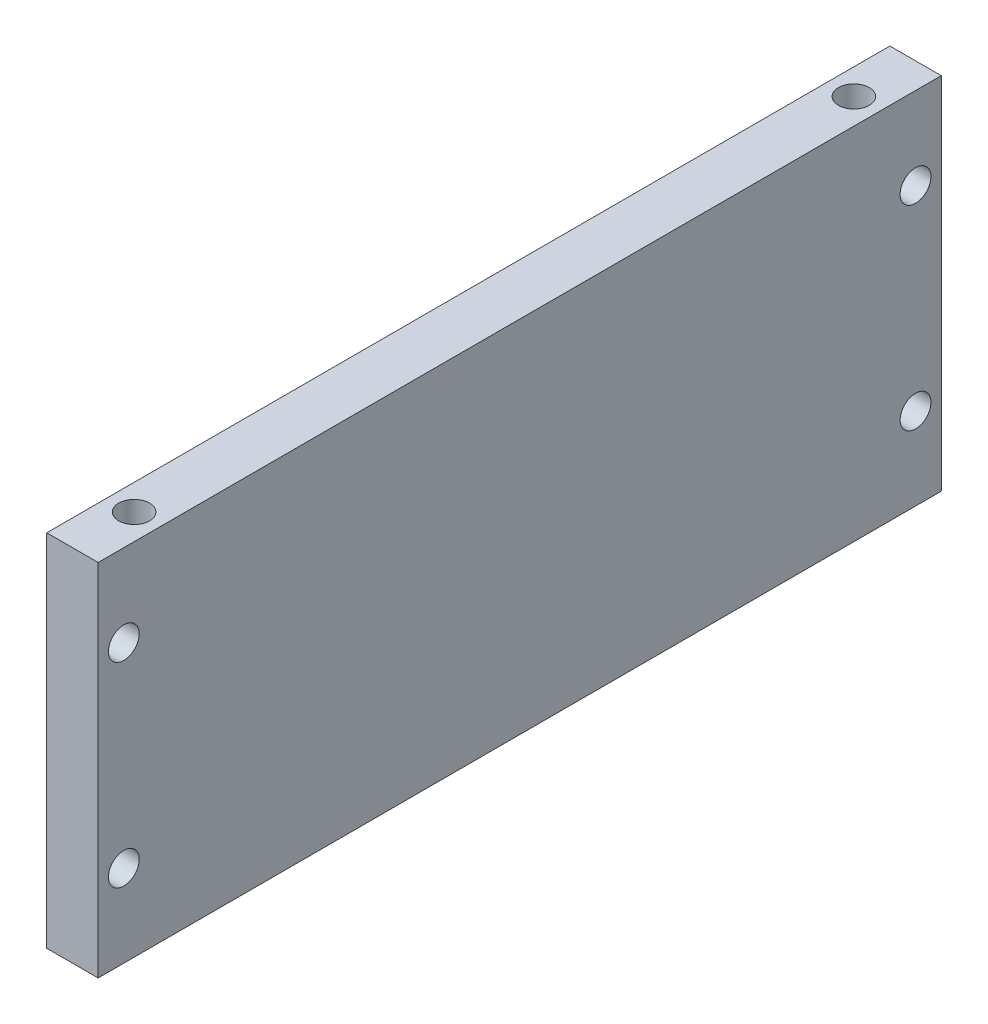
from build123d import *

# Parameters (mm, degrees)
SKETCH1_W           = 82
SKETCH1_H           = 35
BOSS_EXTRUDE1_DEPTH = 5
SKETCH2_R           = 1.5
CUT_EXTRUDE1_DEPTH  = 4
SKETCH3_R           = 1.5
CUT_EXTRUDE2_DEPTH  = 4
CUT_EXTRUDE3_START  = -4
SKETCH4_R           = 1.5
CUT_EXTRUDE3_DEPTH  = 4


with BuildPart() as part:
    # Sketch1 → Boss-Extrude1 (new body)
    with BuildSketch(Plane(origin=(0, 0, 0), x_dir=(0, 0, -1), z_dir=(1, 0, 0))):
        Rectangle(SKETCH1_W, SKETCH1_H)
    extrude(amount=BOSS_EXTRUDE1_DEPTH)

    # Sketch2 → Cut-Extrude1 (cut)
    with BuildSketch(Plane(origin=(5, 0, 0), x_dir=(0, 0, -1), z_dir=(1, 0, 0))):
        with Locations((-38.5, 9.5)):
            Circle(SKETCH2_R)
        with Locations(Location((-38.5, -9.5, 0), (0, 0, 180))):
            Circle(SKETCH2_R)
        with Locations((38.5, -9.5)):
            Circle(SKETCH2_R)
        with Locations(Location((38.5, 9.5, 0), (0, 0, 180))):
            Circle(SKETCH2_R)
    extrude(amount=-CUT_EXTRUDE1_DEPTH, mode=Mode.SUBTRACT)

    # Sketch3 → Cut-Extrude2 (cut)
    with BuildSketch(Plane.XZ.offset(17.5)):
        with Locations(Location((2.5, 35, 0), (0, 0, 270))):
            Circle(SKETCH3_R)
        with Locations(Location((2.5, -35, 0), (0, 0, 90))):
            Circle(SKETCH3_R)
    extrude(amount=-CUT_EXTRUDE2_DEPTH, mode=Mode.SUBTRACT)

    # Sketch4 → Cut-Extrude3 (cut)
    with BuildSketch(Plane(origin=(0, 17.5, 0), x_dir=(1, 0, 0), z_dir=(0, 1, 0)).offset(CUT_EXTRUDE3_START)):
        with Locations(Location((2.5, -35, 0), (0, 0, 90))):
            Circle(SKETCH4_R)
        with Locations(Location((2.5, 35, 0), (0, 0, 270))):
            Circle(SKETCH4_R)
    extrude(amount=CUT_EXTRUDE3_DEPTH, mode=Mode.SUBTRACT)


solid = part.part
